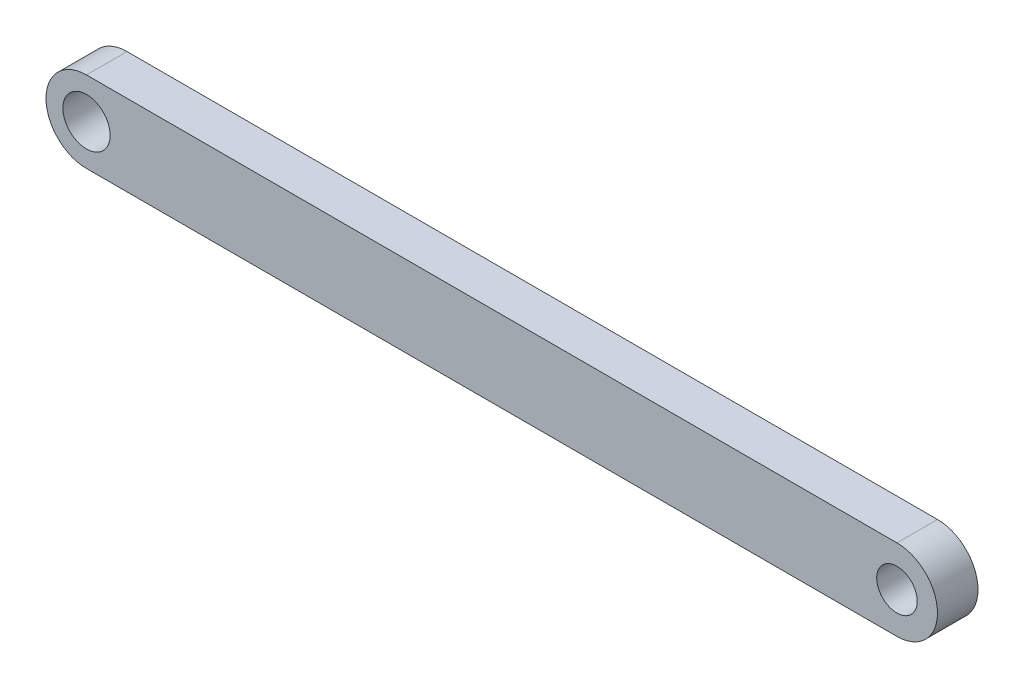
from build123d import *

# Parameters (mm, degrees)
SKETCH1_R           = 1.75
SKETCH1_R_2         = 1.5
BOSS_EXTRUDE1_DEPTH = 3


with BuildPart() as part:
    # Sketch1 → Boss-Extrude1 (new body)
    with BuildSketch(Plane.XY):
        with BuildLine():
            Line((0, 3), (60, 3))
            ThreePointArc((60, 3), (63, 0), (60, -3))
            Line((60, -3), (0, -3))
            ThreePointArc((0, -3), (-3, 0), (0, 3))
        make_face()
        Circle(SKETCH1_R, mode=Mode.SUBTRACT)
        with Locations((60, 0)):
            Circle(SKETCH1_R_2, mode=Mode.SUBTRACT)
    extrude(amount=BOSS_EXTRUDE1_DEPTH)


solid = part.part
